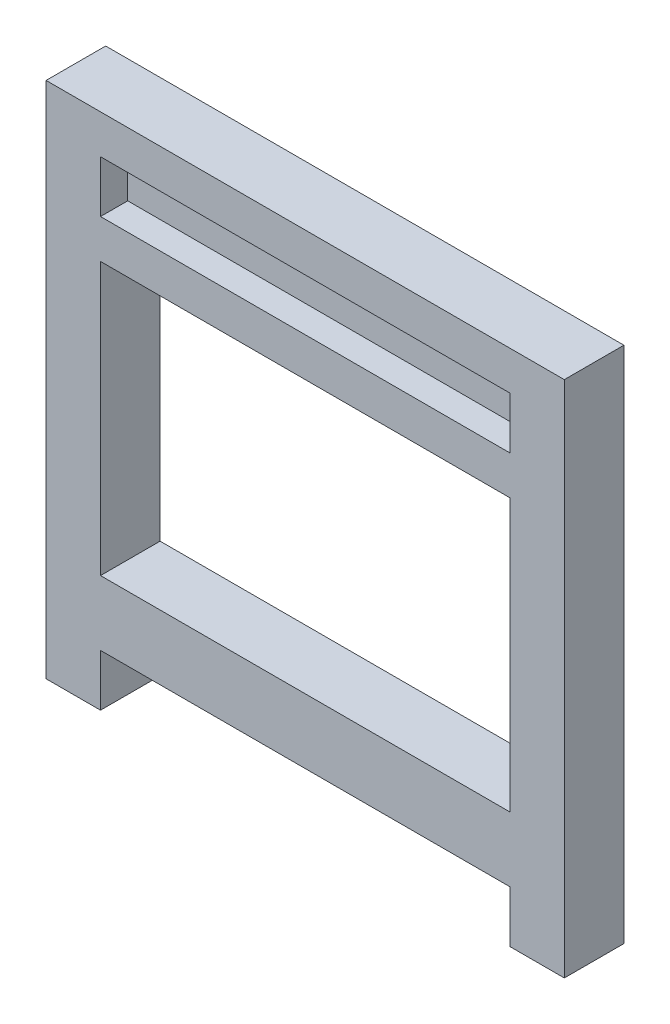
from build123d import *

# Parameters (mm, degrees)
SKETCH1_W           = 15.8
SKETCH1_H           = 10.5
SKETCH1_H_2         = 2
BOSS_EXTRUDE1_DEPTH = 2.3
SKETCH1_2_W         = 15.8
SKETCH1_2_H         = 2
BOSS_EXTRUDE2_DEPTH = 1.25


with BuildPart() as part:
    # Sketch1 → Boss-Extrude1 (new body)
    with BuildSketch(Plane.XY):
        Polygon((0, 0), (0, -2), (2.1, -2), (2.1, 0), (17.9, 0), (17.9, -2), (20, -2), (20, 0), (20, 18), (0, 18), align=None)
        with Locations((10, 7.75)):
            Rectangle(SKETCH1_W, SKETCH1_H, mode=Mode.SUBTRACT)
        with Locations((10, 15.5)):
            Rectangle(SKETCH1_W, SKETCH1_H_2, mode=Mode.SUBTRACT)
    extrude(amount=BOSS_EXTRUDE1_DEPTH)

    # Sketch1<2> → Boss-Extrude2 (add)
    with BuildSketch(Plane.XY):
        with Locations((10, 15.5)):
            Rectangle(SKETCH1_2_W, SKETCH1_2_H)
    extrude(amount=BOSS_EXTRUDE2_DEPTH)


solid = part.part
